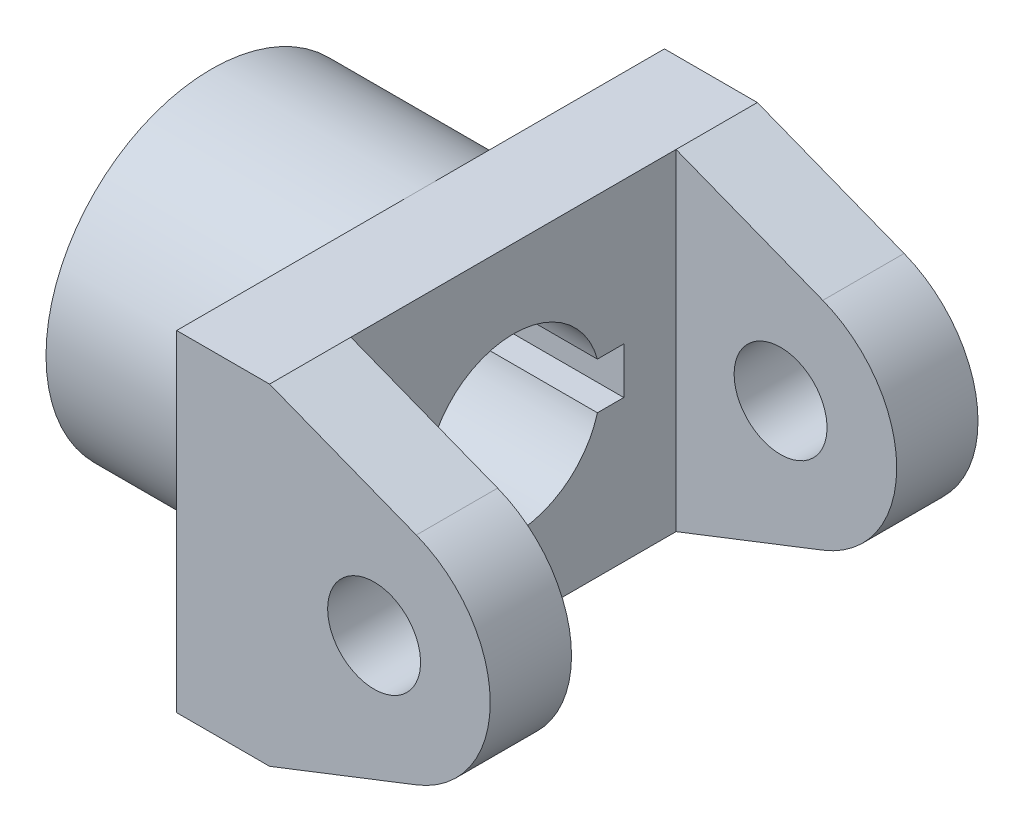
from build123d import *

# Parameters (mm, degrees)
SKETCH1_W               = 16
SKETCH1_H               = 57
BOSS_EXTRUDE1_DEPTH     = 42
SKETCH3_R               = 8
BOSS_EXTRUDE4_DEPTH     = 14
SKETCH6_R               = 28.5
SKETCH6_R_2             = 15
BOSS_EXTRUDE5_DEPTH     = 36
CUT_EXTRUDE1_START      = -36
SKETCH8_R               = 15
CUT_EXTRUDE1_DEPTH      = 36
CUT_EXTRUDE3_DEPTH      = 104.325940596
CUT_EXTRUDE3_DEPTH_BACK = 104.325940596


with BuildPart() as part:
    # Sketch1 → Boss-Extrude1 (new, symmetric)
    with BuildSketch(Plane.XY):
        Rectangle(SKETCH1_W, SKETCH1_H)
    extrude(amount=BOSS_EXTRUDE1_DEPTH, both=True)

    # Sketch3 → Boss-Extrude4 (add)
    with BuildSketch(Plane(origin=(0, 0, -42), x_dir=(-1, 0, 0), z_dir=(0, 0, -1))):
        with BuildLine():
            Line((-33.275105345, 18.629891095), (-8, 28.5))
            Line((-8, 28.5), (-8, -28.5))
            Line((-8, -28.5), (-33.275105345, -18.629891095))
            ThreePointArc((-33.275105345, -18.629891095), (-46, 0), (-33.275105345, 18.629891095))
        make_face()
        with Locations((-26, 0)):
            Circle(SKETCH3_R, mode=Mode.SUBTRACT)
    boss_extrude4 = extrude(amount=-BOSS_EXTRUDE4_DEPTH)

    # Mirror6: Boss-Extrude4 across plane
    add(boss_extrude4.mirror(Plane.XY))

    # Sketch6 → Boss-Extrude5 (add)
    with BuildSketch(Plane.ZY.offset(8)):
        with Locations(Location((0, 0, 0), (0, 0, 270))):
            Circle(SKETCH6_R)
        with Locations(Location((0, 0, 0), (0, 0, 270))):
            Circle(SKETCH6_R_2, mode=Mode.SUBTRACT)
    extrude(amount=BOSS_EXTRUDE5_DEPTH)

    # Sketch8 → Cut-Extrude1 (cut)
    with BuildSketch(Plane.ZY.offset(8).offset(CUT_EXTRUDE1_START)):
        with Locations(Location((0, 0, 0), (0, 0, 270))):
            Circle(SKETCH8_R)
    extrude(amount=CUT_EXTRUDE1_DEPTH, mode=Mode.SUBTRACT)

    # Sketch9 → Cut-Extrude3 (cut, two sides: drawn at the far end of the back side and taken through both)
    with BuildSketch(Plane.ZY.offset(44).offset(-CUT_EXTRUDE3_DEPTH_BACK)):
        with BuildLine():
            ThreePointArc((-14.456832295, -4), (-14.863587797, -2.018355219), (-15, 0))
            Line((-15, 0), (-19, 0))
            Line((-19, 0), (-19, -4))
            Line((-19, -4), (-14.456832295, -4))
        make_face()
        with BuildLine():
            Line((-19, 0), (-15, 0))
            ThreePointArc((-15, 0), (-14.863587797, 2.018355219), (-14.456832295, 4))
            Line((-14.456832295, 4), (-19, 4))
            Line((-19, 4), (-19, 0))
        make_face()
        with BuildLine():
            ThreePointArc((-14.456832295, 4), (-14.863587797, 2.018355219), (-15, 0))
            ThreePointArc((-15, 0), (-14.863587797, -2.018355219), (-14.456832295, -4))
            Line((-14.456832295, -4), (-12.246493105, -4))
            Line((-12.246493105, -4), (-12.246493105, 4))
            Line((-12.246493105, 4), (-14.456832295, 4))
        make_face()
        with BuildLine():
            ThreePointArc((15, 0), (2.018355219, 14.863587797), (-14.456832295, 4))
            Line((-14.456832295, 4), (-12.246493105, 4))
            Line((-12.246493105, 4), (-12.246493105, -4))
            Line((-12.246493105, -4), (-14.456832295, -4))
            ThreePointArc((-14.456832295, -4), (2.018355219, -14.863587797), (15, 0))
        make_face()
    extrude(amount=CUT_EXTRUDE3_DEPTH + CUT_EXTRUDE3_DEPTH_BACK, mode=Mode.SUBTRACT)


solid = part.part
